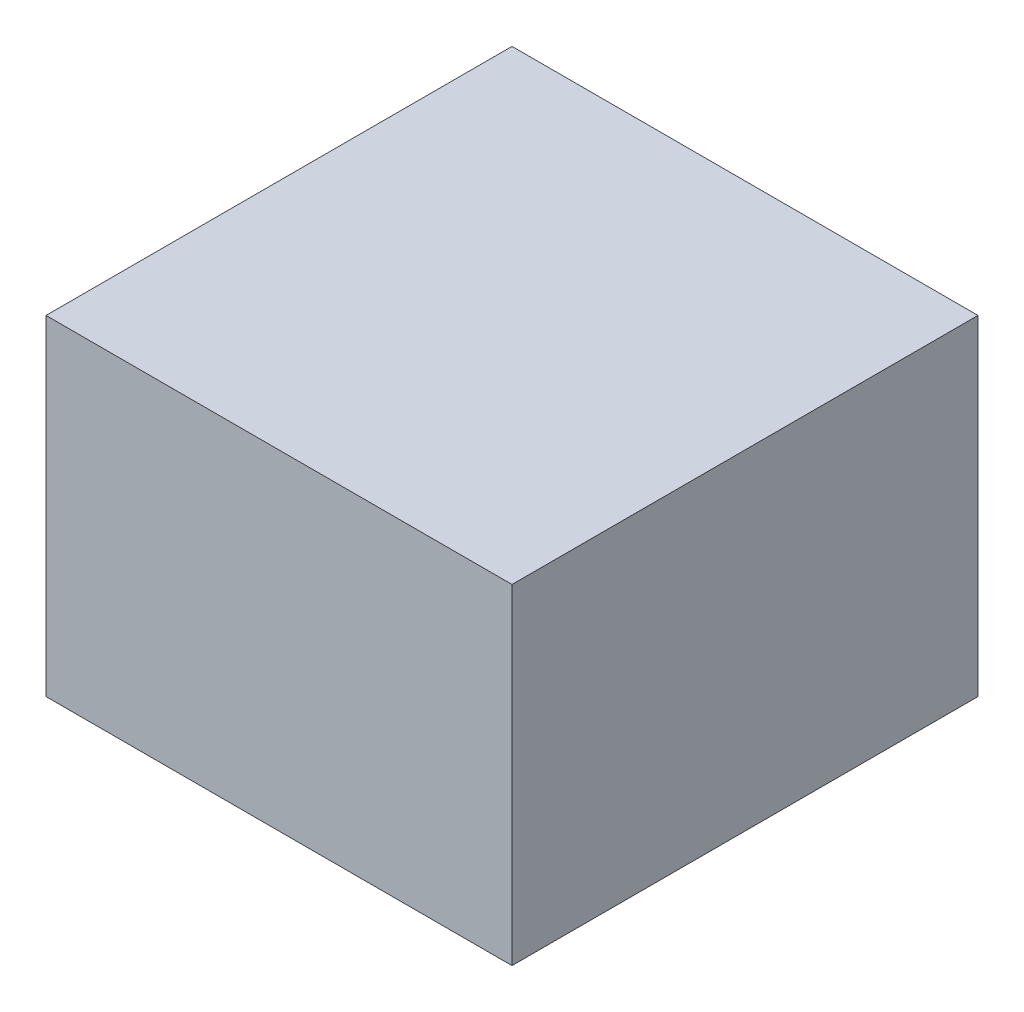
from build123d import *

# Parameters (mm, degrees)
SKETCH1_W           = 60.96
SKETCH1_H           = 43.18
BOSS_EXTRUDE1_DEPTH = 60.96


with BuildPart() as part:
    # Sketch1 → Boss-Extrude1 (new body)
    with BuildSketch(Plane.XY):
        Rectangle(SKETCH1_W, SKETCH1_H)
    extrude(amount=BOSS_EXTRUDE1_DEPTH)


solid = part.part
